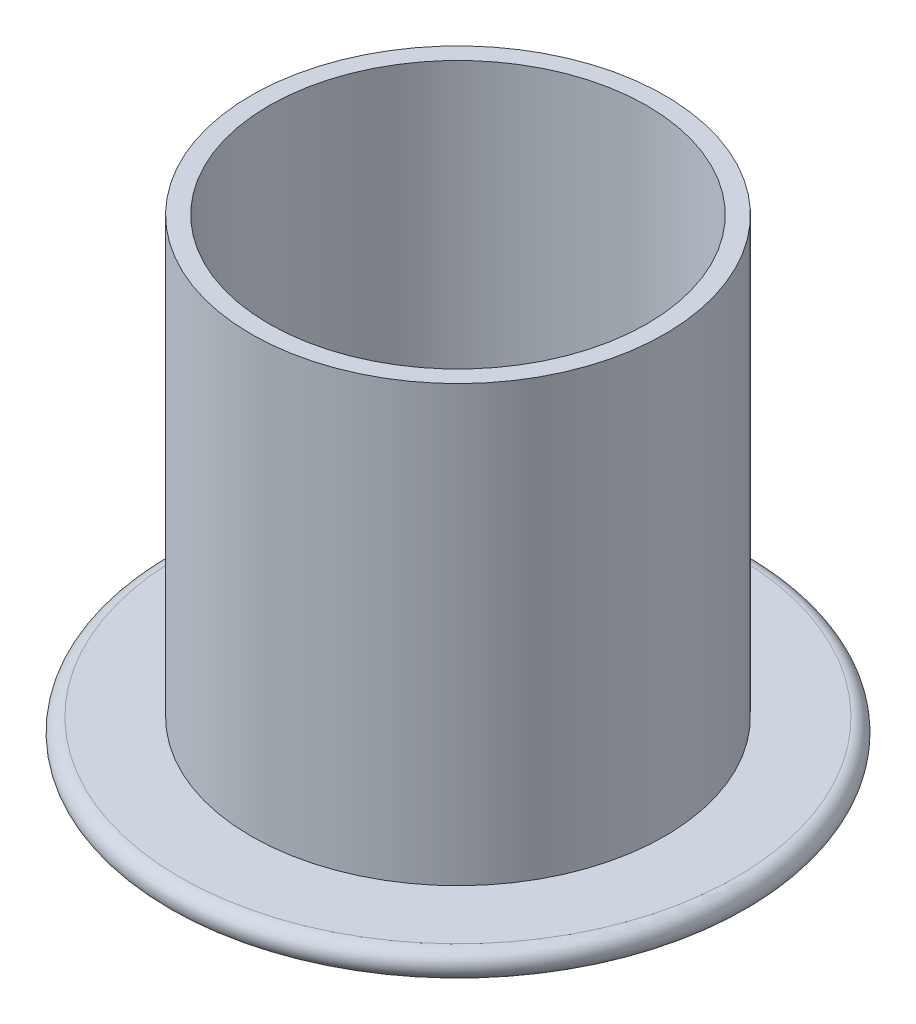
from build123d import *


with BuildPart() as part:
    # Sketch1 → Revolve1 (revolve)
    with BuildSketch(Plane.XY, mode=Mode.PRIVATE) as revolve1_sk:
        with BuildLine():
            Line((21.25, 30.186126987), (23.25, 30.186126987))
            Line((23.25, 30.186126987), (23.25, -18.705501629))
            Line((23.25, -18.705501629), (31.25, -18.705501629))
            ThreePointArc((31.25, -18.705501629), (32.734043095, -19.987290512), (31.681779603, -21.642013507))
            Line((31.681779603, -21.642013507), (25.25, -23.575245866))
            Line((25.25, -23.575245866), (25.25, -25.575245866))
            Line((25.25, -25.575245866), (21.25, -25.575245866))
            Line((21.25, -25.575245866), (21.25, 30.186126987))
        make_face()
    revolve(revolve1_sk.sketch.rotate(Axis((0, 43.602183426, 0), (0, -1, 0)), 90), axis=Axis((0, 43.602183426, 0), (0, -1, 0)))


solid = part.part
